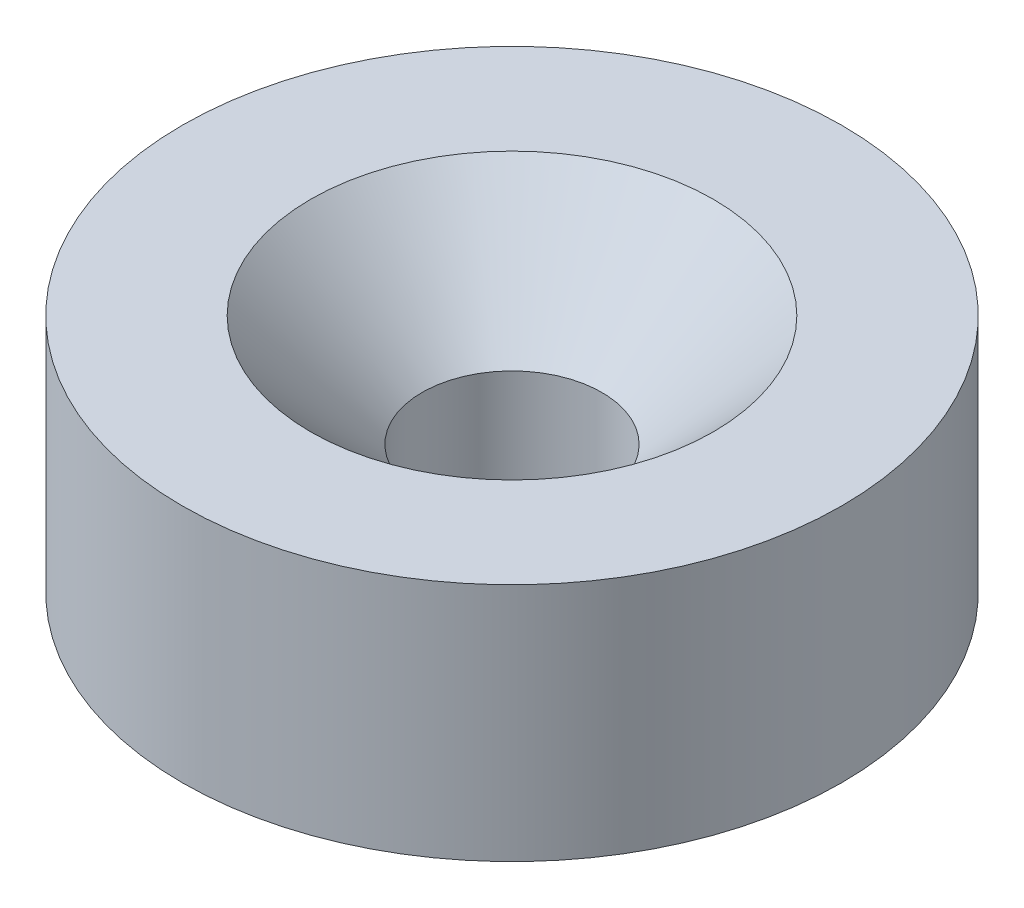
from build123d import *

# Parameters (mm, degrees)
SKETCH2_R                     = 5.5
BOSS_EXTRUDE1_DEPTH           = 4
CSK_FOR_M3_SFHCS1_D           = 3
CSK_FOR_M3_SFHCS1_DEPTH       = 31.098709071
CSK_FOR_M3_SFHCS1_CSINK_D     = 6.72
CSK_FOR_M3_SFHCS1_CSINK_ANGLE = 90
CSK_FOR_M3_SFHCS1_TIP         = 0.901290929


with BuildPart() as part:
    # Sketch2 → Boss-Extrude1 (new body)
    with BuildSketch(Plane(origin=(0, 0, 0), x_dir=(1, 0, 0), z_dir=(0, 1, 0))):
        with Locations(Location((0, 0, 0), (0, 0, 270))):
            Circle(SKETCH2_R)
    extrude(amount=BOSS_EXTRUDE1_DEPTH)

    # CSK for M3 SFHCS1
    with Locations(Plane(origin=(0, 4, 0), x_dir=(1, 0, 0), z_dir=(0, 1, 0))):
        with Locations((0, 0)):
            CounterSinkHole(CSK_FOR_M3_SFHCS1_D / 2, CSK_FOR_M3_SFHCS1_CSINK_D / 2, depth=CSK_FOR_M3_SFHCS1_DEPTH, counter_sink_angle=CSK_FOR_M3_SFHCS1_CSINK_ANGLE)
            with Locations((0, 0, -(CSK_FOR_M3_SFHCS1_DEPTH + CSK_FOR_M3_SFHCS1_TIP / 2))):  # 118° drill point
                Cone(0, CSK_FOR_M3_SFHCS1_D / 2, CSK_FOR_M3_SFHCS1_TIP, mode=Mode.SUBTRACT)


solid = part.part
